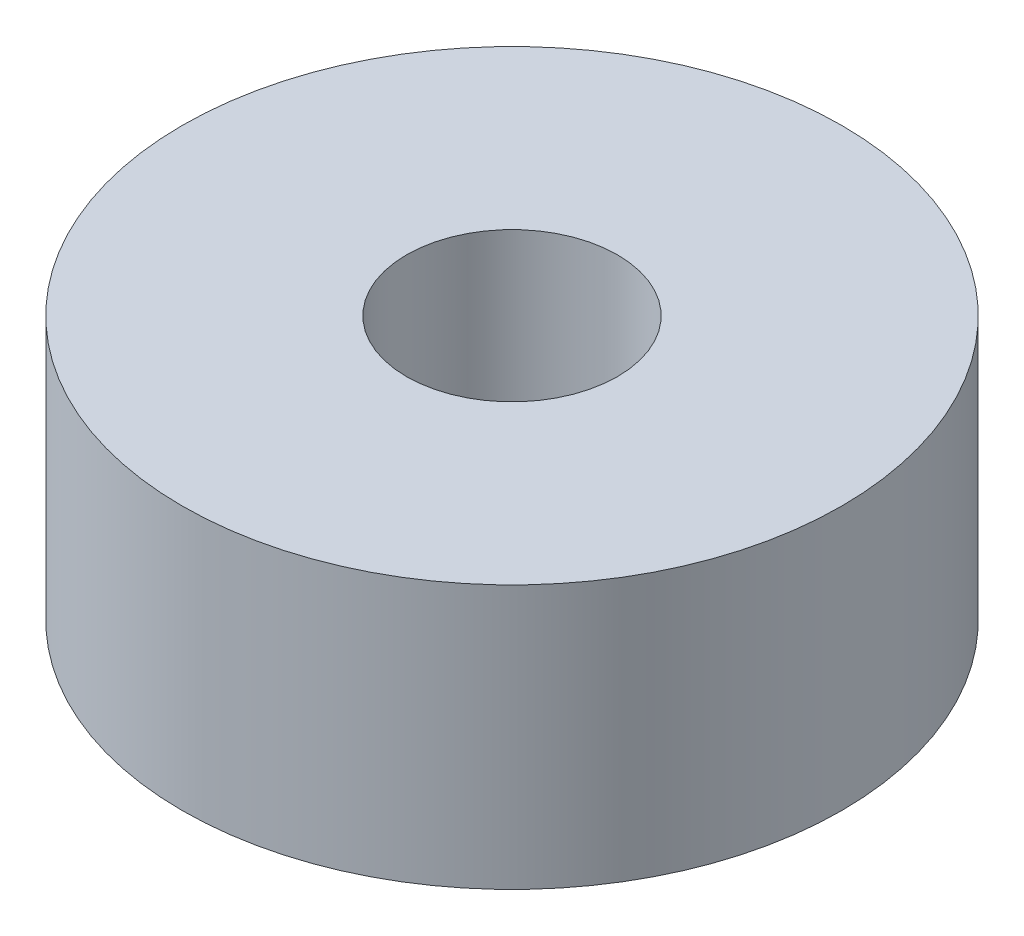
from build123d import *

# Parameters (mm, degrees)
SKETCH_1_R      = 5
SKETCH_1_R_2    = 1.6
EXTRUDE_1_DEPTH = 4


with BuildPart() as part:
    # 草图1 → 凸台-拉伸1 (new body)
    with BuildSketch(Plane(origin=(0, 0, 0), x_dir=(1, 0, 0), z_dir=(0, 1, 0))):
        with Locations(Location((0, 0, 0), (0, 0, 270))):
            Circle(SKETCH_1_R)
        with Locations(Location((0, 0, 0), (0, 0, 270))):
            Circle(SKETCH_1_R_2, mode=Mode.SUBTRACT)
    extrude(amount=EXTRUDE_1_DEPTH)


solid = part.part
